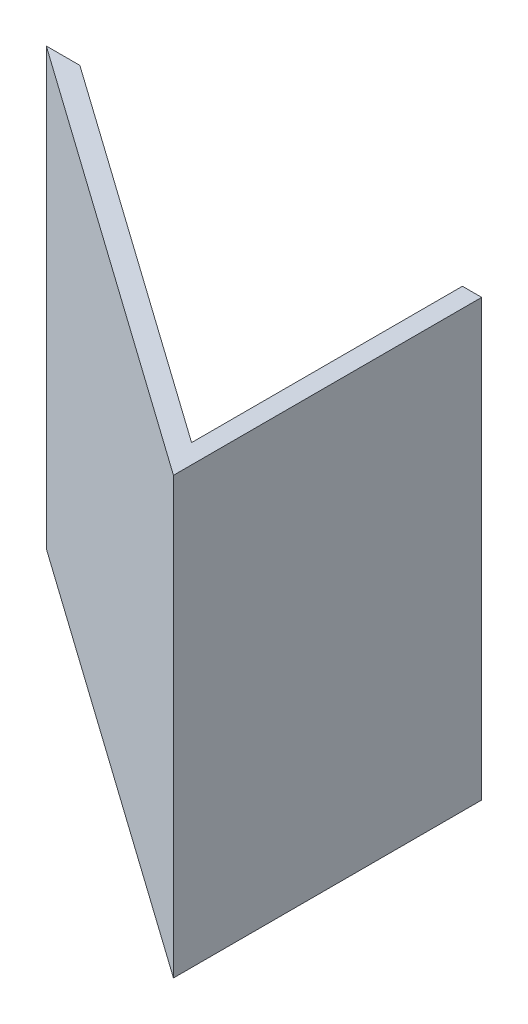
from build123d import *

# Parameters (mm, degrees)
BOSS_EXTRUDE1_DEPTH = 71.755


with BuildPart() as part:
    # Sketch1 → Boss-Extrude1 (new body)
    with BuildSketch(Plane(origin=(0, 0, 0), x_dir=(1, 0, 0), z_dir=(0, 1, 0))):
        Polygon((65.027116768, 34.190845126), (65.027116768, -16.609154874), (-6.727883232, 34.190845126), (-1.200843232, 34.190845126), (61.852116768, -10.449654874), (61.852116768, 34.190845126), align=None)
    extrude(amount=BOSS_EXTRUDE1_DEPTH)


solid = part.part
